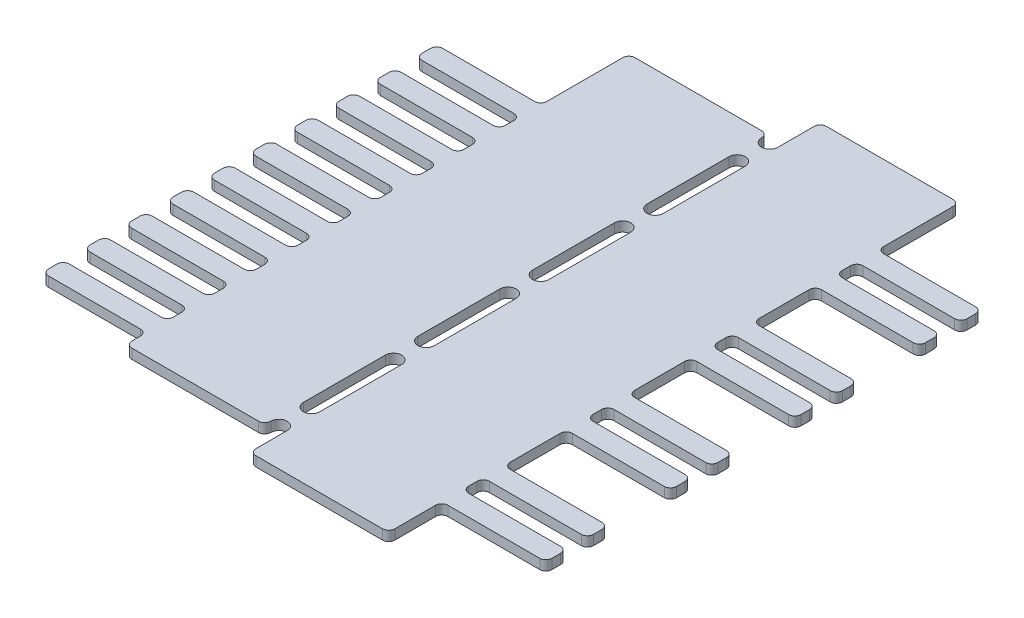
from build123d import *

# Parameters (mm, degrees)
BOSS_EXTRUDE1_DEPTH   = 1.2
CUT_EXTRUDE1_DEPTH    = 86.179974759
BODY_MOVE_COPY1_ANGLE = 180


with BuildPart() as part:
    # Sketch1 → Boss-Extrude1 (new body)
    with BuildSketch(Plane(origin=(0, 0, 0), x_dir=(1, 0, 0), z_dir=(0, 1, 0))):
        with BuildLine():
            Line((-0.75, 10), (-12, 10))
            ThreePointArc((-12, 10), (-12.530330086, 10.219669914), (-12.75, 10.75))
            Line((-12.75, 10.75), (-12.75, 11.79))
            ThreePointArc((-12.75, 11.79), (-12.530330086, 12.320330086), (-12, 12.54))
            Line((-12, 12.54), (-0.75, 12.54))
            ThreePointArc((-0.75, 12.54), (-0.219669914, 12.759669914), (0, 13.29))
            Line((0, 13.29), (0, 14.33))
            ThreePointArc((0, 14.33), (-0.219669914, 14.860330086), (-0.75, 15.08))
            Line((-0.75, 15.08), (-12, 15.08))
            ThreePointArc((-12, 15.08), (-12.530330086, 15.299669914), (-12.75, 15.83))
            Line((-12.75, 15.83), (-12.75, 16.87))
            ThreePointArc((-12.75, 16.87), (-12.530330086, 17.400330086), (-12, 17.62))
            Line((-12, 17.62), (-0.75, 17.62))
            ThreePointArc((-0.75, 17.62), (-0.219669914, 17.839669914), (0, 18.37))
            Line((0, 18.37), (0, 24.49))
            ThreePointArc((0, 24.49), (-0.219669914, 25.020330086), (-0.75, 25.24))
            Line((-0.75, 25.24), (-12, 25.24))
            ThreePointArc((-12, 25.24), (-12.530330086, 25.459669914), (-12.75, 25.99))
            Line((-12.75, 25.99), (-12.75, 27.03))
            ThreePointArc((-12.75, 27.03), (-12.530330086, 27.560330086), (-12, 27.78))
            Line((-12, 27.78), (-0.75, 27.78))
            ThreePointArc((-0.75, 27.78), (-0.219669914, 27.999669914), (0, 28.53))
            Line((0, 28.53), (0, 29.57))
            ThreePointArc((0, 29.57), (-0.219669914, 30.100330086), (-0.75, 30.32))
            Line((-0.75, 30.32), (-12, 30.32))
            ThreePointArc((-12, 30.32), (-12.530330086, 30.539669914), (-12.75, 31.07))
            Line((-12.75, 31.07), (-12.75, 32.11))
            ThreePointArc((-12.75, 32.11), (-12.530330086, 32.640330086), (-12, 32.86))
            Line((-12, 32.86), (-0.75, 32.86))
            ThreePointArc((-0.75, 32.86), (-0.219669914, 33.079669914), (0, 33.61))
            Line((0, 33.61), (0, 39.73))
            ThreePointArc((0, 39.73), (-0.219669914, 40.260330086), (-0.75, 40.48))
            Line((-0.75, 40.48), (-12, 40.48))
            ThreePointArc((-12, 40.48), (-12.530330086, 40.699669914), (-12.75, 41.23))
            Line((-12.75, 41.23), (-12.75, 42.27))
            ThreePointArc((-12.75, 42.27), (-12.530330086, 42.800330086), (-12, 43.02))
            Line((-12, 43.02), (-0.75, 43.02))
            ThreePointArc((-0.75, 43.02), (-0.219669914, 43.239669914), (0, 43.77))
            Line((0, 43.77), (0, 44.81))
            ThreePointArc((0, 44.81), (-0.219669914, 45.340330086), (-0.75, 45.56))
            Line((-0.75, 45.56), (-12, 45.56))
            ThreePointArc((-12, 45.56), (-12.530330086, 45.779669914), (-12.75, 46.31))
            Line((-12.75, 46.31), (-12.75, 47.35))
            ThreePointArc((-12.75, 47.35), (-12.530330086, 47.880330086), (-12, 48.1))
            Line((-12, 48.1), (-0.75, 48.1))
            ThreePointArc((-0.75, 48.1), (-0.219669914, 48.319669914), (0, 48.85))
            Line((0, 48.85), (0, 54.97))
            ThreePointArc((0, 54.97), (-0.219669914, 55.500330086), (-0.75, 55.72))
            Line((-0.75, 55.72), (-12, 55.72))
            ThreePointArc((-12, 55.72), (-12.530330086, 55.939669914), (-12.75, 56.47))
            Line((-12.75, 56.47), (-12.75, 57.51))
            ThreePointArc((-12.75, 57.51), (-12.530330086, 58.040330086), (-12, 58.26))
            Line((-12, 58.26), (-0.75, 58.26))
            ThreePointArc((-0.75, 58.26), (-0.219669914, 58.479669914), (0, 59.01))
            Line((0, 59.01), (0, 60.05))
            ThreePointArc((0, 60.05), (-0.219669914, 60.580330086), (-0.75, 60.8))
            Line((-0.75, 60.8), (-12, 60.8))
            ThreePointArc((-12, 60.8), (-12.530330086, 61.019669914), (-12.75, 61.55))
            Line((-12.75, 61.55), (-12.75, 62.59))
            ThreePointArc((-12.75, 62.59), (-12.530330086, 63.120330086), (-12, 63.34))
            Line((-12, 63.34), (-0.75, 63.34))
            ThreePointArc((-0.75, 63.34), (-0.219669914, 63.559669914), (0, 64.09))
            Line((0, 64.09), (0, 69.09))
            ThreePointArc((0, 69.09), (0.219669914, 69.620330086), (0.75, 69.84))
            Line((0.75, 69.84), (16.25, 69.84))
            ThreePointArc((16.25, 69.84), (16.780330086, 69.620330086), (17, 69.09))
            Line((17, 69.09), (17, 65.27050991))
            ThreePointArc((17, 65.27050991), (18, 64.27050991), (19, 65.27050991))
            ThreePointArc((19, 65.27050991), (19.219669914, 65.800839996), (19.75, 66.02050991))
            Line((19.75, 66.02050991), (35.25, 66.02050991))
            ThreePointArc((35.25, 66.02050991), (35.780330086, 65.800839996), (36, 65.27050991))
            Line((36, 65.27050991), (36, 64.23050991))
            ThreePointArc((36, 64.23050991), (36.219669914, 63.700179824), (36.75, 63.48050991))
            Line((36.75, 63.48050991), (48, 63.48050991))
            ThreePointArc((48, 63.48050991), (48.530330086, 63.260839996), (48.75, 62.73050991))
            Line((48.75, 62.73050991), (48.75, 61.69050991))
            ThreePointArc((48.75, 61.69050991), (48.530330086, 61.160179824), (48, 60.94050991))
            Line((48, 60.94050991), (36.75, 60.94050991))
            ThreePointArc((36.75, 60.94050991), (36.219669914, 60.720839996), (36, 60.19050991))
            Line((36, 60.19050991), (36, 59.15050991))
            ThreePointArc((36, 59.15050991), (36.219669914, 58.620179824), (36.75, 58.40050991))
            Line((36.75, 58.40050991), (48, 58.40050991))
            ThreePointArc((48, 58.40050991), (48.530330086, 58.180839996), (48.75, 57.65050991))
            Line((48.75, 57.65050991), (48.75, 56.61050991))
            ThreePointArc((48.75, 56.61050991), (48.530330086, 56.080179824), (48, 55.86050991))
            Line((48, 55.86050991), (36.75, 55.86050991))
            ThreePointArc((36.75, 55.86050991), (36.219669914, 55.640839996), (36, 55.11050991))
            Line((36, 55.11050991), (36, 54.07050991))
            ThreePointArc((36, 54.07050991), (36.219669914, 53.540179824), (36.75, 53.32050991))
            Line((36.75, 53.32050991), (48, 53.32050991))
            ThreePointArc((48, 53.32050991), (48.530330086, 53.100839996), (48.75, 52.57050991))
            Line((48.75, 52.57050991), (48.75, 51.53050991))
            ThreePointArc((48.75, 51.53050991), (48.530330086, 51.000179824), (48, 50.78050991))
            Line((48, 50.78050991), (36.75, 50.78050991))
            ThreePointArc((36.75, 50.78050991), (36.219669914, 50.560839996), (36, 50.03050991))
            Line((36, 50.03050991), (36, 48.99050991))
            ThreePointArc((36, 48.99050991), (36.219669914, 48.460179824), (36.75, 48.24050991))
            Line((36.75, 48.24050991), (48, 48.24050991))
            ThreePointArc((48, 48.24050991), (48.530330086, 48.020839996), (48.75, 47.49050991))
            Line((48.75, 47.49050991), (48.75, 46.45050991))
            ThreePointArc((48.75, 46.45050991), (48.530330086, 45.920179824), (48, 45.70050991))
            Line((48, 45.70050991), (36.75, 45.70050991))
            ThreePointArc((36.75, 45.70050991), (36.219669914, 45.480839996), (36, 44.95050991))
            Line((36, 44.95050991), (36, 43.91050991))
            ThreePointArc((36, 43.91050991), (36.219669914, 43.380179824), (36.75, 43.16050991))
            Line((36.75, 43.16050991), (48, 43.16050991))
            ThreePointArc((48, 43.16050991), (48.530330086, 42.940839996), (48.75, 42.41050991))
            Line((48.75, 42.41050991), (48.75, 41.37050991))
            ThreePointArc((48.75, 41.37050991), (48.530330086, 40.840179824), (48, 40.62050991))
            Line((48, 40.62050991), (36.75, 40.62050991))
            ThreePointArc((36.75, 40.62050991), (36.219669914, 40.400839996), (36, 39.87050991))
            Line((36, 39.87050991), (36, 38.83050991))
            ThreePointArc((36, 38.83050991), (36.219669914, 38.300179824), (36.75, 38.08050991))
            Line((36.75, 38.08050991), (48, 38.08050991))
            ThreePointArc((48, 38.08050991), (48.530330086, 37.860839996), (48.75, 37.33050991))
            Line((48.75, 37.33050991), (48.75, 36.29050991))
            ThreePointArc((48.75, 36.29050991), (48.530330086, 35.760179824), (48, 35.54050991))
            Line((48, 35.54050991), (36.75, 35.54050991))
            ThreePointArc((36.75, 35.54050991), (36.219669914, 35.320839996), (36, 34.79050991))
            Line((36, 34.79050991), (36, 33.75050991))
            ThreePointArc((36, 33.75050991), (36.219669914, 33.220179824), (36.75, 33.00050991))
            Line((36.75, 33.00050991), (48, 33.00050991))
            ThreePointArc((48, 33.00050991), (48.530330086, 32.780839996), (48.75, 32.25050991))
            Line((48.75, 32.25050991), (48.75, 31.21050991))
            ThreePointArc((48.75, 31.21050991), (48.530330086, 30.680179824), (48, 30.46050991))
            Line((48, 30.46050991), (36.75, 30.46050991))
            ThreePointArc((36.75, 30.46050991), (36.219669914, 30.240839996), (36, 29.71050991))
            Line((36, 29.71050991), (36, 28.67050991))
            ThreePointArc((36, 28.67050991), (36.219669914, 28.140179824), (36.75, 27.92050991))
            Line((36.75, 27.92050991), (48, 27.92050991))
            ThreePointArc((48, 27.92050991), (48.530330086, 27.700839996), (48.75, 27.17050991))
            Line((48.75, 27.17050991), (48.75, 26.13050991))
            ThreePointArc((48.75, 26.13050991), (48.530330086, 25.600179824), (48, 25.38050991))
            Line((48, 25.38050991), (36.75, 25.38050991))
            ThreePointArc((36.75, 25.38050991), (36.219669914, 25.160839996), (36, 24.63050991))
            Line((36, 24.63050991), (36, 23.59050991))
            ThreePointArc((36, 23.59050991), (36.219669914, 23.060179824), (36.75, 22.84050991))
            Line((36.75, 22.84050991), (48, 22.84050991))
            ThreePointArc((48, 22.84050991), (48.530330086, 22.620839996), (48.75, 22.09050991))
            Line((48.75, 22.09050991), (48.75, 21.05050991))
            ThreePointArc((48.75, 21.05050991), (48.530330086, 20.520179824), (48, 20.30050991))
            Line((48, 20.30050991), (36.75, 20.30050991))
            ThreePointArc((36.75, 20.30050991), (36.219669914, 20.080839996), (36, 19.55050991))
            Line((36, 19.55050991), (36, 18.51050991))
            ThreePointArc((36, 18.51050991), (36.219669914, 17.980179824), (36.75, 17.76050991))
            Line((36.75, 17.76050991), (48, 17.76050991))
            ThreePointArc((48, 17.76050991), (48.530330086, 17.540839996), (48.75, 17.01050991))
            Line((48.75, 17.01050991), (48.75, 15.97050991))
            ThreePointArc((48.75, 15.97050991), (48.530330086, 15.440179824), (48, 15.22050991))
            Line((48, 15.22050991), (36.75, 15.22050991))
            ThreePointArc((36.75, 15.22050991), (36.219669914, 15.000839996), (36, 14.47050991))
            Line((36, 14.47050991), (36, 5.18300671))
            ThreePointArc((36, 5.18300671), (35.780330086, 4.652676624), (35.25, 4.43300671))
            Line((35.25, 4.43300671), (19.75, 4.43300671))
            ThreePointArc((19.75, 4.43300671), (19.219669914, 4.652676624), (19, 5.18300671))
            ThreePointArc((19, 5.18300671), (18, 6.18300671), (17, 5.18300671))
            Line((17, 5.18300671), (17, 0.75))
            ThreePointArc((17, 0.75), (16.780330086, 0.219669914), (16.25, 0))
            Line((16.25, 0), (0.75, 0))
            ThreePointArc((0.75, 0), (0.219669914, 0.219669914), (0, 0.75))
            Line((0, 0.75), (0, 9.25))
            ThreePointArc((0, 9.25), (-0.219669914, 9.780330086), (-0.75, 10))
        make_face()
    extrude(amount=BOSS_EXTRUDE1_DEPTH)

    # Sketch2 → Cut-Extrude1 (cut, through all)
    with BuildSketch(Plane.XZ):
        with BuildLine():
            Line((17, -61.27050991), (17, -51.25050991))
            ThreePointArc((17, -51.25050991), (18, -50.25050991), (19, -51.25050991))
            Line((19, -51.25050991), (19, -61.27050991))
            ThreePointArc((19, -61.27050991), (18, -62.27050991), (17, -61.27050991))
        make_face()
        with BuildLine():
            Line((17, -47.25050991), (17, -37.23050991))
            ThreePointArc((17, -37.23050991), (18, -36.23050991), (19, -37.23050991))
            Line((19, -37.23050991), (19, -47.25050991))
            ThreePointArc((19, -47.25050991), (18, -48.25050991), (17, -47.25050991))
        make_face()
        with BuildLine():
            Line((17, -23.20300671), (17, -33.22300671))
            ThreePointArc((17, -33.22300671), (18, -34.22300671), (19, -33.22300671))
            Line((19, -33.22300671), (19, -23.20300671))
            ThreePointArc((19, -23.20300671), (18, -22.20300671), (17, -23.20300671))
        make_face()
        with BuildLine():
            Line((17, -9.18300671), (17, -19.20300671))
            ThreePointArc((17, -19.20300671), (18, -20.20300671), (19, -19.20300671))
            Line((19, -19.20300671), (19, -9.18300671))
            ThreePointArc((19, -9.18300671), (18, -8.18300671), (17, -9.18300671))
        make_face()
    extrude(amount=-CUT_EXTRUDE1_DEPTH, mode=Mode.SUBTRACT)


with BuildPart() as part_1:
    # Body-Move/Copy1: moved
    add(part.part.rotate(Axis((17.625, 0, -34.92), (0, 1, 0)), BODY_MOVE_COPY1_ANGLE))


solid = part_1.part
